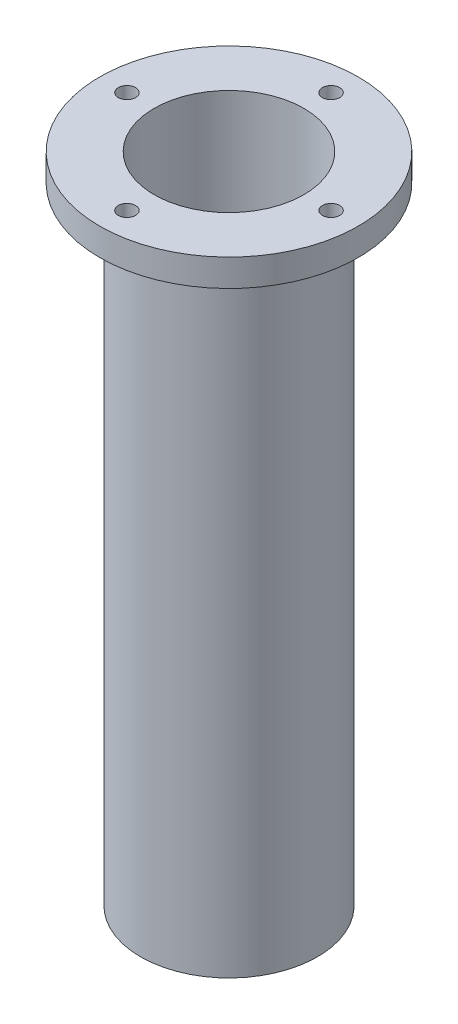
from build123d import *

# Parameters (mm, degrees)
SKETCH1_R                  = 20.6375
SKETCH1_R_2                = 17.4625
BOSS_EXTRUDE1_DEPTH        = 152.4
BOSS_EXTRUDE2_START        = -6.35
SKETCH2_R                  = 30.1625
SKETCH2_R_2                = 17.4625
BOSS_EXTRUDE2_DEPTH        = 6.35
F_10_32_TAPPED_HOLE1_D     = 4.0386
F_10_32_TAPPED_HOLE1_DEPTH = 6.35


with BuildPart() as part:
    # Sketch1 → Boss-Extrude1 (new body)
    with BuildSketch(Plane(origin=(0, 0, 0), x_dir=(1, 0, 0), z_dir=(0, 1, 0))):
        with Locations(Location((0, 0, 0), (0, 0, 90))):
            Circle(SKETCH1_R)
        with Locations(Location((0, 0, 0), (0, 0, 90))):
            Circle(SKETCH1_R_2, mode=Mode.SUBTRACT)
    extrude(amount=BOSS_EXTRUDE1_DEPTH)

    # Sketch2 → Boss-Extrude2 (add)
    with BuildSketch(Plane(origin=(0, 152.4, 0), x_dir=(1, 0, 0), z_dir=(0, 1, 0)).offset(BOSS_EXTRUDE2_START)):
        with Locations(Location((0, 0, 0), (0, 0, 270))):
            Circle(SKETCH2_R)
        with Locations(Location((0, 0, 0), (0, 0, 90))):
            Circle(SKETCH2_R_2, mode=Mode.SUBTRACT)
    extrude(amount=BOSS_EXTRUDE2_DEPTH)

    # #10-32 Tapped Hole1
    with Locations(Plane(origin=(0, 152.4, 0), x_dir=(1, 0, 0), z_dir=(0, 1, 0))):
        with Locations((-23.8125, 0), (0, 23.8125), (23.8125, 0), (0, -23.8125), (0, 0)):
            Hole(F_10_32_TAPPED_HOLE1_D / 2, depth=F_10_32_TAPPED_HOLE1_DEPTH)


solid = part.part
